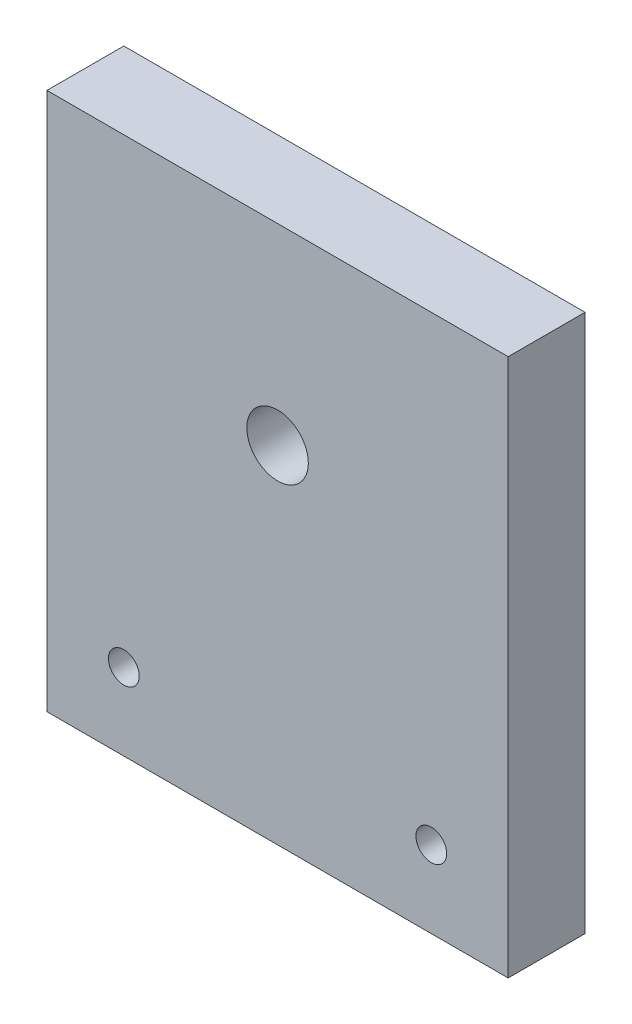
from build123d import *

# Parameters (mm, degrees)
SKETCH1_W           = 60
SKETCH1_H           = 70
SKETCH1_R           = 11
SKETCH1_R_2         = 2
SKETCH1_R_3         = 4
BOSS_EXTRUDE1_DEPTH = 10


with BuildPart() as part:
    # Sketch1 → Boss-Extrude1 (new body)
    # profile 1 of 2: a face of its own
    with BuildSketch(Plane.XY):
        with Locations((0, -10)):
            Rectangle(SKETCH1_W, SKETCH1_H)
        Circle(SKETCH1_R, mode=Mode.SUBTRACT)
        with Locations((20, -35)):
            Circle(SKETCH1_R_2, mode=Mode.SUBTRACT)
        with Locations((-20, -35)):
            Circle(SKETCH1_R_2, mode=Mode.SUBTRACT)
    # profile 2 of 2: a face of its own
    with BuildSketch(Plane.XY):
        Circle(SKETCH1_R)
        Circle(SKETCH1_R_3, mode=Mode.SUBTRACT)
    extrude(amount=BOSS_EXTRUDE1_DEPTH)


solid = part.part
